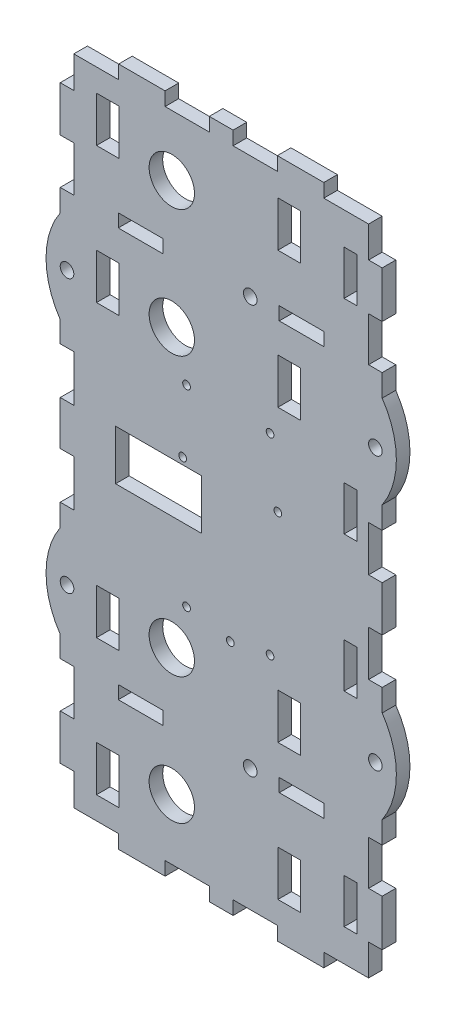
from build123d import *

# Parameters (mm, degrees)
CROQUIS1_R                               = 1.5
CROQUIS1_R_2                             = 1.506117052
SALIENTE_EXTRUIR1_DEPTH                  = 1.5
CROQUIS3_W                               = 13
CROQUIS3_H                               = 10.999999999
CORTAR_EXTRUIR2_DEPTH                    = 10
TALADRO_DE_MARGEN_PARA_M1_61_D           = 1.7
TALADRO_DE_MARGEN_PARA_M1_61_CSINK_D     = 1.75
TALADRO_DE_MARGEN_PARA_M1_61_CSINK_ANGLE = 90
CROQUIS10_W                              = 5
CROQUIS10_H                              = 10
CORTAR_EXTRUIR3_DEPTH                    = 10
TALADRO_DE_MARGEN_PARA_M1_62_D           = 1.7
TALADRO_DE_MARGEN_PARA_M1_62_DEPTH       = 10
TALADRO_DE_MARGEN_PARA_M1_62_TIP         = 0.510731526
CROQUIS14_W                              = 2.8
CROQUIS14_H                              = 9.8
CORTAR_EXTRUIR4_DEPTH                    = 10
CROQUIS15_R                              = 5
CORTAR_EXTRUIR5_DEPTH                    = 10


with BuildPart() as part:
    # Croquis1 → Saliente-Extruir1 (new, symmetric)
    with BuildSketch(Plane.XY):
        with BuildLine():
            Line((205.355115241, 182.028523427), (195.480115242, 182.028523427))
            Line((195.480115242, 182.028523427), (195.480115242, 175.028523428))
            Line((195.480115242, 175.028523428), (192.480115242, 175.028523428))
            Line((192.480115242, 175.028523428), (192.480115242, 165.028523428))
            Line((192.480115242, 165.028523428), (195.480115242, 165.028523428))
            Line((195.480115242, 165.028523428), (195.480115242, 155.028523429))
            Line((195.480115242, 155.028523429), (192.480115242, 155.028523429))
            Line((192.480115242, 155.028523429), (192.480115242, 150.148106778))
            ThreePointArc((192.480115242, 150.148106778), (189.350724152, 139.96602343), (192.480115242, 129.783940083))
            Line((192.480115242, 129.783940083), (192.480115242, 125.153523431))
            Line((192.480115242, 125.153523431), (195.480115242, 125.153523431))
            Line((195.480115242, 125.153523431), (195.480115242, 114.903523432))
            Line((195.480115242, 114.903523432), (192.480115242, 114.903523432))
            Line((192.480115242, 114.903523432), (192.480115242, 105.153523433))
            Line((192.480115242, 105.153523433), (195.480115242, 105.153523433))
            Line((195.480115242, 105.153523433), (195.480115242, 94.903523434))
            Line((195.480115242, 94.903523434), (192.480115242, 94.903523434))
            Line((192.480115242, 94.903523434), (192.480115242, 90.023106782))
            ThreePointArc((192.480115242, 90.023106782), (189.350724152, 79.841023435), (192.480115242, 69.658940087))
            Line((192.480115242, 69.658940087), (192.480115242, 65.028523436))
            Line((192.480115242, 65.028523436), (195.480115242, 65.028523436))
            Line((195.480115242, 65.028523436), (195.480115242, 55.028523436))
            Line((195.480115242, 55.028523436), (192.480115242, 55.028523436))
            Line((192.480115242, 55.028523436), (192.480115242, 45.028523437))
            Line((192.480115242, 45.028523437), (195.480115242, 45.028523437))
            Line((195.480115242, 45.028523437), (195.480115242, 38.028637727))
            Line((195.480115242, 38.028637727), (205.355115241, 38.028637727))
            Line((205.355115241, 38.028637727), (205.355115241, 35.028637727))
            Line((205.355115241, 35.028637727), (215.605115241, 35.028637727))
            Line((215.605115241, 35.028637727), (215.605115241, 38.028620144))
            Line((215.605115241, 38.028620144), (225.355044383, 38.028620144))
            Line((225.355044383, 38.028620144), (225.355044383, 35.028598165))
            Line((225.355044383, 35.028598165), (230.605044383, 35.028598165))
            Line((230.605044383, 35.028598165), (230.605044383, 38.028598165))
            Line((230.605044383, 38.028598165), (240.354973525, 38.028598165))
            Line((240.354973525, 38.028598165), (240.354973525, 35.028589374))
            Line((240.354973525, 35.028589374), (250.604973524, 35.028589374))
            Line((250.604973524, 35.028589374), (250.604973524, 38.028580582))
            Line((250.604973524, 38.028580582), (260.479973524, 38.028580582))
            Line((260.479973524, 38.028580582), (260.479973524, 44.903580582))
            Line((260.479973524, 44.903580582), (263.479973523, 44.903580582))
            Line((263.479973523, 44.903580582), (263.479973523, 55.153580581))
            Line((263.479973523, 55.153580581), (260.479973524, 55.153580581))
            Line((260.479973524, 55.153580581), (260.479973524, 64.90358058))
            Line((260.479973524, 64.90358058), (263.479973523, 64.90358058))
            Line((263.479973523, 64.90358058), (263.479973523, 69.783997232))
            ThreePointArc((263.479973523, 69.783997232), (266.609364614, 79.966080579), (263.479973523, 90.148163927))
            Line((263.479973523, 90.148163927), (263.479973523, 95.028580578))
            Line((263.479973523, 95.028580578), (260.479973524, 95.028580578))
            Line((260.479973524, 95.028580578), (260.479973524, 105.028580577))
            Line((260.479973524, 105.028580577), (263.479973523, 105.028580577))
            Line((263.479973523, 105.028580577), (263.479973523, 115.028580577))
            Line((263.479973523, 115.028580577), (260.479973524, 115.028580577))
            Line((260.479973524, 115.028580577), (260.479973524, 125.028580576))
            Line((260.479973524, 125.028580576), (263.479973523, 125.028580576))
            Line((263.479973523, 125.028580576), (263.479973523, 129.908997227))
            ThreePointArc((263.479973523, 129.908997227), (266.609364614, 140.091080575), (263.479973523, 150.273163922))
            Line((263.479973523, 150.273163922), (263.479973523, 155.153580574))
            Line((263.479973523, 155.153580574), (260.479973524, 155.153580574))
            Line((260.479973524, 155.153580574), (260.479973524, 164.903580573))
            Line((260.479973524, 164.903580573), (263.479973523, 164.903580573))
            Line((263.479973523, 164.903580573), (263.479973523, 175.153580572))
            Line((263.479973523, 175.153580572), (260.479973524, 175.153580572))
            Line((260.479973524, 175.153580572), (260.479973524, 182.028580572))
            Line((260.479973524, 182.028580572), (250.604973524, 182.028580572))
            Line((250.604973524, 182.028580572), (250.604973524, 185.02857178))
            Line((250.604973524, 185.02857178), (240.354973525, 185.02857178))
            Line((240.354973525, 185.02857178), (240.354973525, 182.028562989))
            Line((240.354973525, 182.028562989), (230.605044383, 182.028562989))
            Line((230.605044383, 182.028562989), (230.605044383, 185.028562989))
            Line((230.605044383, 185.028562989), (225.355044383, 185.028562989))
            Line((225.355044383, 185.028562989), (225.355044383, 182.02854101))
            Line((225.355044383, 182.02854101), (215.605115241, 182.02854101))
            Line((215.605115241, 182.02854101), (215.605115241, 185.028523427))
            Line((215.605115241, 185.028523427), (205.355115241, 185.028523427))
            Line((205.355115241, 185.028523427), (205.355115241, 182.028523427))
        make_face()
        Polygon((215.180079812, 63.578494864), (210.095175212, 63.578494864), (205.280079813, 63.578494864), (205.280079813, 65.17614563), (205.280079813, 66.478494863), (210.095175212, 66.478494863), (215.180079812, 66.478494863), (215.180079812, 65.17614563), align=None, mode=Mode.SUBTRACT)
        with Locations((193.980115242, 79.841023435)):
            Circle(CROQUIS1_R, mode=Mode.SUBTRACT)
        Polygon((204.687627513, 115.528523432), (207.487627511, 115.528523432), (210.687627512, 115.528523432), (210.687627512, 109.828523436), (210.687627512, 104.528523433), (207.487627511, 104.528523433), (204.687627513, 104.528523433), (204.687627513, 110.228523436), align=None, mode=Mode.SUBTRACT)
        with Locations((234.380026668, 65.028523436)):
            Circle(CROQUIS1_R_2, mode=Mode.SUBTRACT)
        Polygon((250.680008953, 63.578523436), (245.595104353, 63.578523436), (240.780008954, 63.578523436), (240.780008954, 65.176174202), (240.780008954, 66.478523436), (245.595104353, 66.478523436), (250.680008953, 66.478523436), (250.680008953, 65.176174202), align=None, mode=Mode.SUBTRACT)
        with Locations((261.979973524, 79.966080579)):
            Circle(CROQUIS1_R, mode=Mode.SUBTRACT)
        with Locations((193.980115242, 139.96602343)):
            Circle(CROQUIS1_R, mode=Mode.SUBTRACT)
        Polygon((215.180079812, 153.675173656), (210.095175212, 153.675173656), (205.280079813, 153.675173656), (205.280079813, 155.272824422), (205.280079813, 156.575173656), (210.095175212, 156.575173656), (215.180079812, 156.575173656), (215.180079812, 155.272824422), align=None, mode=Mode.SUBTRACT)
        with Locations((261.979973524, 140.091080575)):
            Circle(CROQUIS1_R, mode=Mode.SUBTRACT)
        with Locations((234.380026668, 155.125202228)):
            Circle(CROQUIS1_R, mode=Mode.SUBTRACT)
        Polygon((250.680008953, 153.675202228), (245.864913553, 153.675202228), (240.780008954, 153.675202228), (240.780008954, 155.272852994), (240.780008954, 156.575202228), (245.864913553, 156.575202228), (250.680008953, 156.575202228), (250.680008953, 155.272852994), align=None, mode=Mode.SUBTRACT)
    extrude(amount=SALIENTE_EXTRUIR1_DEPTH, both=True)

    # Croquis3 → Cortar-Extruir2 (cut)
    with BuildSketch(Plane(origin=(0, 0, -1.5), x_dir=(-1, 0, 0), z_dir=(0, 0, -1))):
        with Locations((-217.187627512, 110.028523433)):
            Rectangle(CROQUIS3_W, CROQUIS3_H)
    extrude(amount=-CORTAR_EXTRUIR2_DEPTH, mode=Mode.SUBTRACT)

    # Taladro de margen para M1.61 (through all)
    with Locations(Plane(origin=(0, 0, -1.5), x_dir=(-1, 0, 0), z_dir=(0, 0, -1))):
        with Locations((-238.760115242, 131.208523432), (-220.340115242, 131.208523432), (-220.340115242, 88.848637722), (-238.760115242, 88.848637722)):
            CounterSinkHole(TALADRO_DE_MARGEN_PARA_M1_61_D / 2, TALADRO_DE_MARGEN_PARA_M1_61_CSINK_D / 2, counter_sink_angle=TALADRO_DE_MARGEN_PARA_M1_61_CSINK_ANGLE)

    # Croquis10 → Cortar-Extruir3 (cut)
    with BuildSketch(Plane(origin=(0, 0, -1.5), x_dir=(-1, 0, 0), z_dir=(0, 0, -1))):
        with Locations((-202.980115242, 142.028580577)):
            Rectangle(CROQUIS10_W, CROQUIS10_H)
        with Locations((-202.980115242, 172.028580577)):
            Rectangle(CROQUIS10_W, CROQUIS10_H)
        with Locations((-202.980115242, 78.028580577)):
            Rectangle(CROQUIS10_W, CROQUIS10_H)
        with Locations((-202.980115242, 48.028580577)):
            Rectangle(CROQUIS10_W, CROQUIS10_H)
        with Locations((-242.980115242, 48.028580577)):
            Rectangle(CROQUIS10_W, CROQUIS10_H)
        with Locations((-242.980115242, 78.028580577)):
            Rectangle(CROQUIS10_W, CROQUIS10_H)
        with Locations((-242.980115242, 172.028580577)):
            Rectangle(CROQUIS10_W, CROQUIS10_H)
        with Locations((-242.980115242, 142.028580577)):
            Rectangle(CROQUIS10_W, CROQUIS10_H)
    extrude(amount=-CORTAR_EXTRUIR3_DEPTH, mode=Mode.SUBTRACT)

    # Taladro de margen para M1.62
    with Locations(Plane(origin=(0, 0, -1.5), x_dir=(-1, 0, 0), z_dir=(0, 0, -1))):
        with Locations((-240.479973524, 117.029100767), (-219.479973524, 117.029100767), (-229.979973524, 87.029100767), (-170.093156085, 124.870857212)):
            Hole(TALADRO_DE_MARGEN_PARA_M1_62_D / 2, depth=TALADRO_DE_MARGEN_PARA_M1_62_DEPTH)
            with Locations((0, 0, -(TALADRO_DE_MARGEN_PARA_M1_62_DEPTH + TALADRO_DE_MARGEN_PARA_M1_62_TIP / 2))):  # 118° drill point
                Cone(0, TALADRO_DE_MARGEN_PARA_M1_62_D / 2, TALADRO_DE_MARGEN_PARA_M1_62_TIP, mode=Mode.SUBTRACT)

    # Croquis14 → Cortar-Extruir4 (cut)
    with BuildSketch(Plane(origin=(0, 0, -1.5), x_dir=(-1, 0, 0), z_dir=(0, 0, -1))):
        with Locations((-256.479973523, 170.028574939)):
            Rectangle(CROQUIS14_W, CROQUIS14_H)
        with Locations((-256.479973523, 50.028586215)):
            Rectangle(CROQUIS14_W, CROQUIS14_H)
        with Locations((-256.479973523, 95.028580577)):
            Rectangle(CROQUIS14_W, CROQUIS14_H)
        with Locations((-256.479973523, 125.028580577)):
            Rectangle(CROQUIS14_W, CROQUIS14_H)
    extrude(amount=-CORTAR_EXTRUIR4_DEPTH, mode=Mode.SUBTRACT)

    # Croquis15 → Cortar-Extruir5 (cut)
    with BuildSketch(Plane(origin=(0, 0, -1.5), x_dir=(-1, 0, 0), z_dir=(0, 0, -1))):
        with Locations((-217.080079819, 51.410663554)):
            Circle(CROQUIS15_R)
        with Locations((-217.080079819, 79.410663554)):
            Circle(CROQUIS15_R)
        with Locations(Location((-217.080079819, 140.6464976, 0), (0, 0, 180))):
            Circle(CROQUIS15_R)
        with Locations(Location((-217.080079819, 168.6464976, 0), (0, 0, 180))):
            Circle(CROQUIS15_R)
    extrude(amount=-CORTAR_EXTRUIR5_DEPTH, mode=Mode.SUBTRACT)


solid = part.part
